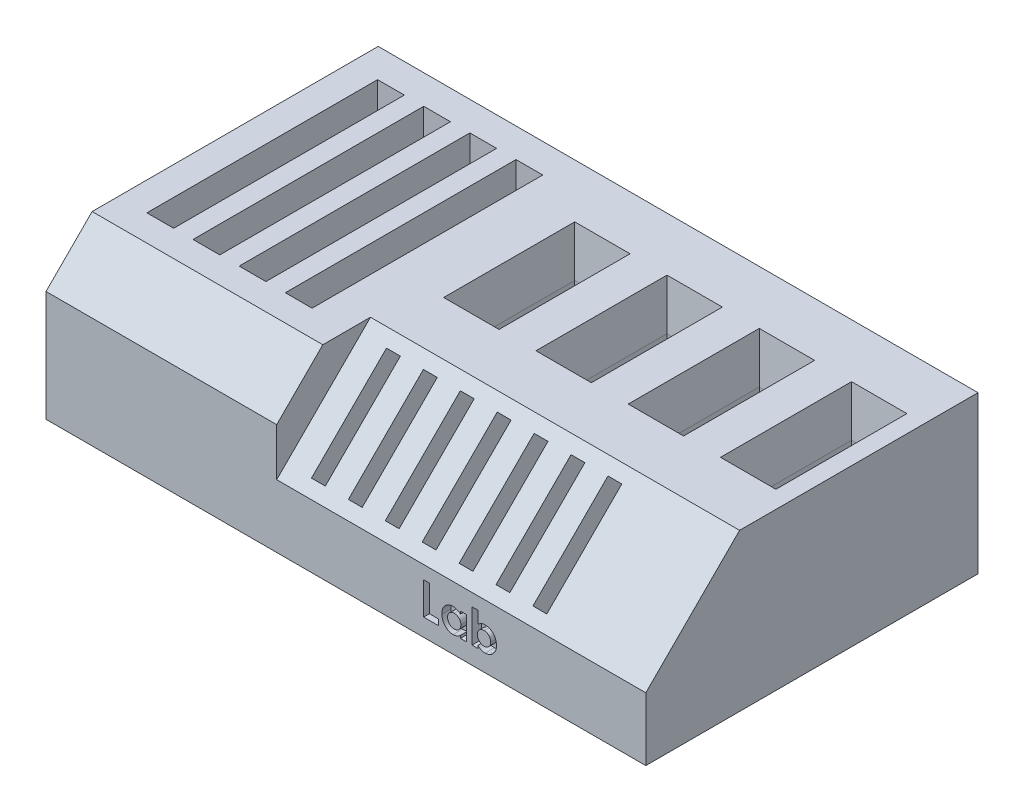
from build123d import *

# Parameters (mm, degrees)
CROQUIS1_W              = 36
CROQUIS1_H              = 17
SALIENTE_EXTRUIR1_DEPTH = 65
CHAFL_N1_SIZE           = 5
CROQUIS2_W              = 2.9
CROQUIS2_H              = 25
CORTAR_EXTRUIR1_DEPTH   = 14
CORTAR_EXTRUIR2_DEPTH   = 40
CROQUIS9_W              = 1.5
CROQUIS9_H              = 11.5
CORTAR_EXTRUIR3_DEPTH   = 10
CROQUIS10_W             = 5
CROQUIS10_H             = 13.2
CORTAR_EXTRUIR4_DEPTH   = 13
CHAFL_N2_SIZE           = 0.5
CHAFL_N2_SIZE2          = 5
CHAFL_N4_SIZE           = 0.5
CHAFL_N4_SIZE2          = 5
CHAFL_N5_SIZE           = 0.5
CHAFL_N5_SIZE2          = 5
CORTAR_EXTRUIR5_DEPTH   = 1


with BuildPart() as part:
    # Croquis1 → Saliente-Extruir1 (new body)
    with BuildSketch(Plane(origin=(0, 0, 0), x_dir=(0, 0, -1), z_dir=(1, 0, 0))):
        Rectangle(CROQUIS1_W, CROQUIS1_H)
    extrude(amount=SALIENTE_EXTRUIR1_DEPTH)

    # Chaflán1
    chafl_n1_edges = [part.edges().sort_by_distance(p)[0] for p in [
        (32.5, 8.5, 18),
    ]]
    chamfer(chafl_n1_edges, length=CHAFL_N1_SIZE)

    # Croquis2 → Cortar-Extruir1 (cut)
    with BuildSketch(Plane(origin=(0, 8.5, 0), x_dir=(1, 0, 0), z_dir=(0, 1, 0))):
        with Locations((9.537285555, 2.346326753)):
            Rectangle(CROQUIS2_W, CROQUIS2_H)
        with Locations((4.537285555, 2.346326753)):
            Rectangle(CROQUIS2_W, CROQUIS2_H)
        with Locations((14.537285555, 2.346326753)):
            Rectangle(CROQUIS2_W, CROQUIS2_H)
        with Locations((19.537285555, 2.346326753)):
            Rectangle(CROQUIS2_W, CROQUIS2_H)
    extrude(amount=-CORTAR_EXTRUIR1_DEPTH, mode=Mode.SUBTRACT)

    # Croquis7 → Cortar-Extruir2 (cut)
    with BuildSketch(Plane(origin=(65, 0, 0), x_dir=(0, 0, -1), z_dir=(1, 0, 0))):
        Polygon((-18, -1.664897079), (-7.835102921, 8.5), (-13, 8.5), (-18, 3.5), align=None)
    extrude(amount=-CORTAR_EXTRUIR2_DEPTH, mode=Mode.SUBTRACT)

    # Croquis9 → Cortar-Extruir3 (cut)
    with BuildSketch(Plane(origin=(0, 8.16755146, 8.16755146), x_dir=(1, 0, 0), z_dir=(0, 0.7071067811865487, 0.7071067811865464))):
        with Locations((28.502109808, -6.717514421)):
            Rectangle(CROQUIS9_W, CROQUIS9_H)
        with Locations((32.502109808, -6.717514421)):
            Rectangle(CROQUIS9_W, CROQUIS9_H)
        with Locations((36.502109808, -6.717514421)):
            Rectangle(CROQUIS9_W, CROQUIS9_H)
        with Locations((40.502109808, -6.717514421)):
            Rectangle(CROQUIS9_W, CROQUIS9_H)
        with Locations((44.502109808, -6.717514421)):
            Rectangle(CROQUIS9_W, CROQUIS9_H)
        with Locations((48.502109808, -6.717514421)):
            Rectangle(CROQUIS9_W, CROQUIS9_H)
        with Locations((52.502109808, -6.717514421)):
            Rectangle(CROQUIS9_W, CROQUIS9_H)
    extrude(amount=-CORTAR_EXTRUIR3_DEPTH, mode=Mode.SUBTRACT)

    # Croquis10 → Cortar-Extruir4 (cut)
    with BuildSketch(Plane(origin=(0, 8.5, 0), x_dir=(1, 0, 0), z_dir=(0, 1, 0))):
        with Locations((40.114166644, 5.08244854)):
            Rectangle(CROQUIS10_W, CROQUIS10_H)
        with Locations((30.114166644, 5.08244854)):
            Rectangle(CROQUIS10_W, CROQUIS10_H)
        with Locations((50.114166644, 5.08244854)):
            Rectangle(CROQUIS10_W, CROQUIS10_H)
        with Locations((60.114166644, 5.08244854)):
            Rectangle(CROQUIS10_W, CROQUIS10_H)
    extrude(amount=-CORTAR_EXTRUIR4_DEPTH, mode=Mode.SUBTRACT)

    # Chaflán2
    chafl_n2_edges = [part.edges().sort_by_distance(p)[0] for p in [
        (27.614166644, 8.5, -5.08244854),
    ]]
    chafl_n2_side = [part.faces().sort_by_distance(p)[0] for p in [
        (0.720138875, 8.5, -2.5),
    ]]
    chamfer(chafl_n2_edges, length=CHAFL_N2_SIZE, length2=CHAFL_N2_SIZE2, reference=chafl_n2_side[0])

    # Chaflán4
    chafl_n4_edges = [part.edges().sort_by_distance(p)[0] for p in [
        (29.864166644, 8.5, 1.51755146),
        (32.614166644, 8.5, -5.08244854),
        (29.864166644, 8.5, -11.68244854),
    ]]
    chafl_n4_side = [part.faces().sort_by_distance(p)[0] for p in [
        (29.864166644, 8.5, 2.237690336),
    ]]
    chamfer(chafl_n4_edges, length=CHAFL_N4_SIZE, length2=CHAFL_N4_SIZE2, reference=chafl_n4_side[0])

    # Chaflán5
    chafl_n5_edges = [part.edges().sort_by_distance(p)[0] for p in [
        (37.614166644, 8.5, -5.08244854),
        (40.114166644, 8.5, 1.51755146),
        (42.614166644, 8.5, -5.08244854),
        (40.114166644, 8.5, -11.68244854),
        (47.614166644, 8.5, -5.08244854),
        (50.114166644, 8.5, 1.51755146),
        (52.614166644, 8.5, -5.08244854),
        (50.114166644, 8.5, -11.68244854),
        (57.614166644, 8.5, -5.08244854),
        (60.114166644, 8.5, 1.51755146),
        (62.614166644, 8.5, -5.08244854),
        (60.114166644, 8.5, -11.68244854),
    ]]
    chafl_n5_side = [part.faces().sort_by_distance(p)[0] for p in [
        (26.394027769, 8.5, -5.08244854),
    ]]
    chamfer(chafl_n5_edges, length=CHAFL_N5_SIZE, length2=CHAFL_N5_SIZE2, reference=chafl_n5_side[0])

    # Croquis11 → Cortar-Extruir5 (cut)
    # profile 1 of 3: a face of its own
    with BuildSketch(Plane.XY.offset(18)):
        Polygon((40.921288965, -3.099012661), (41.549494093, -3.099012661), (41.549494093, -5.970807532), (42.536673581, -5.970807532), (42.536673581, -6.599012661), (40.921288965, -6.599012661), align=None)
    # profile 2 of 3: a face of its own
    with BuildSketch(Plane.XY.offset(18)):
        with BuildLine():
            Line((44.914878709, -4.041320353), (45.543083837, -4.041320353))
            Line((45.543083837, -4.041320353), (45.543083837, -6.599012661))
            Line((45.543083837, -6.599012661), (44.914878709, -6.599012661))
            Line((44.914878709, -6.599012661), (44.914878709, -6.319966186))
            add(Edge.make_bspline(
                [(44.914878709, -6.319966186), (44.883751376, -6.347128272), (44.82333937, -6.399844517), (44.728149598, -6.468245185), (44.63268167, -6.524666896), (44.53647686, -6.569603711), (44.438056541, -6.602784924), (44.336712126, -6.626808898), (44.230984148, -6.640976423), (44.159111725, -6.642905014), (44.122611081, -6.643884456)],
                knots=[0, 0, 0, 0, 1.129196829, 2.191548051, 3.199897424, 4.157751732, 5.089409408, 6.034969131, 7.002052659, 8, 8, 8, 8], degree=3))
            add(Edge.make_bspline(
                [(44.122611081, -6.643884456), (44.081637484, -6.642962678), (44.000671336, -6.641141193), (43.881862503, -6.621967123), (43.767140762, -6.592616936), (43.656599237, -6.551082753), (43.550439047, -6.497262594), (43.447847746, -6.432560703), (43.35058406, -6.354705656), (43.257838303, -6.267066042), (43.172920844, -6.170661844), (43.0986852, -6.066831137), (43.036110069, -5.957046532), (42.984845613, -5.841672015), (42.944519498, -5.720792265), (42.915772749, -5.594023887), (42.898812133, -5.461321606), (42.896712887, -5.370930009), (42.895647939, -5.325074359)],
                knots=[0, 0, 0, 0, 0.980476535, 1.937477201, 2.874147792, 3.812856188, 4.758993464, 5.720109578, 6.712210464, 7.737600662, 8.772720504, 9.783789959, 10.789002326, 11.793715968, 12.802552247, 13.835794126, 14.902098527, 16, 16, 16, 16], degree=3))
            add(Edge.make_bspline(
                [(42.895647939, -5.325074359), (42.896765606, -5.277590773), (42.898958033, -5.184446429), (42.914995506, -5.047761532), (42.94321177, -4.917849943), (42.981686674, -4.794531714), (43.031177957, -4.677785542), (43.091455033, -4.567420158), (43.163337916, -4.463724041), (43.246170194, -4.368462171), (43.335608711, -4.281150065), (43.431292112, -4.205137953), (43.531724119, -4.140562127), (43.637011458, -4.087843194), (43.747139094, -4.04710467), (43.861672245, -4.017321482), (43.981119356, -3.999450523), (44.062487696, -3.997457523), (44.103680792, -3.996448558)],
                knots=[0, 0, 0, 0, 1.136281865, 2.228943489, 3.287578264, 4.313574083, 5.316051562, 6.317280042, 7.318008486, 8.329309503, 9.333984563, 10.305318864, 11.248632312, 12.186624717, 13.117503092, 14.05354244, 15.014596925, 16, 16, 16, 16], degree=3))
            add(Edge.make_bspline(
                [(44.103680792, -3.996448558), (44.141838946, -3.997241302), (44.217340179, -3.998809856), (44.328316113, -4.015841349), (44.435946763, -4.041600274), (44.539644998, -4.078302105), (44.640261386, -4.124645634), (44.736065262, -4.182717529), (44.829152421, -4.250077056), (44.885950224, -4.302686273), (44.914878709, -4.329481411)],
                knots=[0, 0, 0, 0, 1.017011718, 2.012299608, 2.98747302, 3.965332399, 4.941441765, 5.936729654, 6.94912688, 8, 8, 8, 8], degree=3))
            Line((44.914878709, -4.329481411), (44.914878709, -4.041320353))
        make_face()
        with BuildLine():
            add(Edge.make_bspline(
                [(44.235491689, -4.579781891), (44.210459567, -4.580549963), (44.161398241, -4.582055334), (44.089246848, -4.591110245), (44.02029176, -4.6070654), (43.95502476, -4.630635717), (43.892473131, -4.659347797), (43.833586727, -4.695309204), (43.777879543, -4.737814823), (43.725679198, -4.785835594), (43.678090892, -4.838619201), (43.637066994, -4.896217552), (43.602203309, -4.9570787), (43.572717693, -5.021385632), (43.551612681, -5.089899299), (43.53489752, -5.161727774), (43.526223434, -5.23745786), (43.524651096, -5.28906557), (43.523853068, -5.315258654)],
                knots=[0, 0, 0, 0, 1.04836806, 2.054732945, 3.03993516, 4.00574415, 4.955904794, 5.917688631, 6.888591924, 7.88601754, 8.884115178, 9.859153345, 10.841239365, 11.818093293, 12.814750328, 13.83810466, 14.90274714, 16, 16, 16, 16], degree=3))
            add(Edge.make_bspline(
                [(43.523853068, -5.315258654), (43.524638906, -5.341689325), (43.52618739, -5.393770655), (43.535037772, -5.470139552), (43.551151452, -5.543017272), (43.574660704, -5.611814651), (43.603370953, -5.677459991), (43.638317783, -5.739650334), (43.681243843, -5.797286076), (43.728873866, -5.851731073), (43.782145093, -5.900348343), (43.838167491, -5.943516014), (43.897706281, -5.979634377), (43.96011551, -6.008825467), (44.025185106, -6.032613751), (44.093730843, -6.048368383), (44.165081229, -6.058440022), (44.213722672, -6.059842563), (44.238296177, -6.060551122)],
                knots=[0, 0, 0, 0, 1.099136573, 2.165835871, 3.191374663, 4.196217796, 5.183857741, 6.167377911, 7.154730987, 8.166690795, 9.170734848, 10.148332609, 11.103258353, 12.059567475, 13.009337315, 13.978056681, 14.978520572, 16, 16, 16, 16], degree=3))
            add(Edge.make_bspline(
                [(44.238296177, -6.060551122), (44.263794552, -6.059778744), (44.313785228, -6.058264464), (44.387113735, -6.049292189), (44.456995137, -6.033278532), (44.52313869, -6.00957327), (44.586554673, -5.981067286), (44.646670814, -5.945808593), (44.702834763, -5.903400512), (44.755330964, -5.854945632), (44.803433612, -5.801731016), (44.845024838, -5.743377353), (44.881252317, -5.681750956), (44.909743562, -5.61539475), (44.932369606, -5.545469661), (44.948603271, -5.471541717), (44.957433444, -5.393531216), (44.958968385, -5.340286009), (44.959750504, -5.313155289)],
                knots=[0, 0, 0, 0, 1.050008698, 2.058587853, 3.036635738, 3.995319155, 4.947022481, 5.895997462, 6.858296291, 7.838991643, 8.833936038, 9.806048392, 10.784806122, 11.771666913, 12.772873988, 13.80724452, 14.882696879, 16, 16, 16, 16], degree=3))
            add(Edge.make_bspline(
                [(44.959750504, -5.313155289), (44.958978104, -5.286491204), (44.957469382, -5.234408501), (44.948565189, -5.158026822), (44.932216274, -5.085550486), (44.910055911, -5.01684627), (44.881057798, -4.952071268), (44.844802908, -4.891943678), (44.803667915, -4.834380306), (44.7550327, -4.78260331), (44.702820883, -4.734499281), (44.645830953, -4.693373652), (44.5858584, -4.657930443), (44.522534755, -4.628830202), (44.455273666, -4.607498622), (44.385272842, -4.590982361), (44.311440123, -4.582060769), (44.261220965, -4.580553913), (44.235491689, -4.579781891)],
                knots=[0, 0, 0, 0, 1.106611376, 2.161533483, 3.185006901, 4.184773755, 5.152708835, 6.122342771, 7.094156588, 8.082475533, 9.064254463, 10.03606828, 10.992420271, 11.951521816, 12.920622147, 13.915721683, 14.932141191, 16, 16, 16, 16], degree=3))
        make_face(mode=Mode.SUBTRACT)
    # profile 3 of 3: a face of its own
    with BuildSketch(Plane.XY.offset(18)):
        with BuildLine():
            Line((46.799494093, -3.009269071), (46.799494093, -4.339297116))
            add(Edge.make_bspline(
                [(46.799494093, -4.339297116), (46.828665066, -4.311830886), (46.88592924, -4.257913216), (46.979425562, -4.188191766), (47.076276616, -4.129347434), (47.176395637, -4.079979793), (47.280683706, -4.04347455), (47.387859455, -4.015108609), (47.499021084, -4.000085409), (47.574194996, -3.997667538), (47.612094254, -3.996448558)],
                knots=[0, 0, 0, 0, 1.061187343, 2.083167259, 3.083809127, 4.061667593, 5.035358583, 6.007314429, 6.995378812, 8, 8, 8, 8], degree=3))
            add(Edge.make_bspline(
                [(47.612094254, -3.996448558), (47.653291261, -3.99743533), (47.734435997, -3.999378951), (47.853825038, -4.017525446), (47.968237876, -4.046858005), (48.078110797, -4.087814252), (48.182858412, -4.1409891), (48.283657633, -4.204655939), (48.378770061, -4.281442014), (48.468241931, -4.368415119), (48.551005641, -4.463744102), (48.622994826, -4.567386939), (48.682959023, -4.677979492), (48.733781627, -4.794214325), (48.770874004, -4.918019154), (48.799461714, -5.047733221), (48.81539239, -5.184453934), (48.81759964, -5.277593308), (48.818724863, -5.325074359)],
                knots=[0, 0, 0, 0, 0.985987466, 1.942075377, 2.884088208, 3.810275091, 4.743821533, 5.692411115, 6.659945104, 7.665215984, 8.677116751, 9.678438675, 10.680260931, 11.685531812, 12.710472044, 13.769734641, 14.863044265, 16, 16, 16, 16], degree=3))
            add(Edge.make_bspline(
                [(48.818724863, -5.325074359), (48.817659914, -5.370930008), (48.815560666, -5.461321602), (48.798600064, -5.594023901), (48.769853265, -5.720792215), (48.729527331, -5.841672198), (48.678262205, -5.957045853), (48.615689579, -6.06683368), (48.541444456, -6.170652194), (48.45656312, -6.267102854), (48.363817926, -6.354446097), (48.267184081, -6.432810351), (48.164736958, -6.497023711), (48.059037505, -6.551256814), (47.948420555, -6.592727818), (47.833641671, -6.621782918), (47.714882635, -6.641208054), (47.634140955, -6.642983436), (47.593163965, -6.643884456)],
                knots=[0, 0, 0, 0, 1.098553145, 2.165490463, 3.199345634, 4.208780719, 5.21409072, 6.219899742, 7.23156933, 8.267303578, 9.293302409, 10.281606823, 11.243293419, 12.184993323, 13.124258899, 14.066907486, 15.018941492, 16, 16, 16, 16], degree=3))
            add(Edge.make_bspline(
                [(47.593163965, -6.643884456), (47.556662682, -6.64290868), (47.484789003, -6.640987307), (47.378844207, -6.626736924), (47.277035106, -6.602770527), (47.178075606, -6.569756661), (47.0816972, -6.524650013), (46.986221456, -6.46825005), (46.891033911, -6.399843183), (46.830621589, -6.347127819), (46.799494093, -6.319966186)],
                knots=[0, 0, 0, 0, 0.996418773, 1.962021009, 2.912343664, 3.848616743, 4.805003894, 5.811808768, 6.872532775, 8, 8, 8, 8], degree=3))
            Line((46.799494093, -6.319966186), (46.799494093, -6.599012661))
            Line((46.799494093, -6.599012661), (46.171288965, -6.599012661))
            Line((46.171288965, -6.599012661), (46.171288965, -3.009269071))
            Line((46.171288965, -3.009269071), (46.799494093, -3.009269071))
        make_face()
        with BuildLine():
            add(Edge.make_bspline(
                [(47.476076625, -4.579781891), (47.450582187, -4.580565863), (47.400599229, -4.582102873), (47.327215143, -4.590911473), (47.257682429, -4.607484917), (47.190943899, -4.628965797), (47.127844655, -4.657961612), (47.067868473, -4.693110501), (47.011529055, -4.735022867), (46.958534001, -4.782039033), (46.910913732, -4.834932308), (46.868607254, -4.891451516), (46.833508394, -4.952332643), (46.80424967, -5.016803724), (46.78217524, -5.085562329), (46.765802409, -5.158023528), (46.756904813, -5.234409382), (46.75539517, -5.286491503), (46.754622298, -5.313155289)],
                knots=[0, 0, 0, 0, 1.060469436, 2.079096586, 3.066888298, 4.028858836, 4.99004353, 5.948472697, 6.914558426, 7.905691313, 8.889602648, 9.869280844, 10.836099585, 11.806137001, 12.808075328, 13.83377171, 14.890985086, 16, 16, 16, 16], degree=3))
            add(Edge.make_bspline(
                [(46.754622298, -5.313155289), (46.755404895, -5.340285713), (46.756940775, -5.393530339), (46.765764198, -5.471545019), (46.782022109, -5.545457951), (46.804561467, -5.615436713), (46.833322315, -5.681490386), (46.868379589, -5.74386384), (46.911151752, -5.801189569), (46.958248895, -5.855477411), (47.011571631, -5.903122664), (47.067657238, -5.945853901), (47.127830084, -5.981055183), (47.191230882, -6.009576541), (47.257378552, -6.033277634), (47.32725882, -6.049292439), (47.400587639, -6.058264397), (47.450578272, -6.059778722), (47.476076625, -6.060551122)],
                knots=[0, 0, 0, 0, 1.117193555, 2.192540452, 3.22680955, 4.227918444, 5.21468246, 6.188555072, 7.166222992, 8.154674427, 9.142376254, 10.104580718, 11.053462639, 12.005072638, 12.963662044, 13.941614018, 14.950094269, 16, 16, 16, 16], degree=3))
            add(Edge.make_bspline(
                [(47.476076625, -6.060551122), (47.500647484, -6.059833586), (47.549283689, -6.058413276), (47.620446696, -6.04850285), (47.688852075, -6.032308228), (47.753964122, -6.009225035), (47.816179199, -5.97917074), (47.876063694, -5.944002241), (47.931550169, -5.900061828), (47.984815451, -5.851767562), (48.032473648, -5.797305519), (48.075228779, -5.739446772), (48.111144359, -5.67767492), (48.139660484, -5.611785117), (48.163235577, -5.543025412), (48.179331036, -5.470137266), (48.188186463, -5.393771257), (48.18973425, -5.341689527), (48.190519734, -5.315258654)],
                knots=[0, 0, 0, 0, 1.021711385, 2.02240246, 2.981887075, 3.941027022, 4.888772411, 5.852236371, 6.822344989, 7.82661704, 8.838806642, 9.826383926, 10.814965113, 11.80282933, 12.807900643, 13.833672313, 14.900613836, 16, 16, 16, 16], degree=3))
            add(Edge.make_bspline(
                [(48.190519734, -5.315258654), (48.189721707, -5.28906557), (48.188149368, -5.23745786), (48.179475282, -5.161727775), (48.162760122, -5.089899297), (48.141655106, -5.02138564), (48.112169506, -4.957078672), (48.077305758, -4.896217654), (48.036282098, -4.838618819), (47.988692886, -4.785837055), (47.936495907, -4.737809441), (47.880776522, -4.69532862), (47.821753544, -4.659165338), (47.758623211, -4.630646494), (47.692875298, -4.607181631), (47.623505041, -4.591018724), (47.550865112, -4.582073267), (47.501340946, -4.580555942), (47.476076625, -4.579781891)],
                knots=[0, 0, 0, 0, 1.094680664, 2.156827393, 3.177782763, 4.17210342, 5.146667393, 6.126451192, 7.099203661, 8.094961544, 9.09004898, 10.058676268, 11.018205477, 11.974998356, 12.947750825, 13.930643515, 14.944335875, 16, 16, 16, 16], degree=3))
        make_face(mode=Mode.SUBTRACT)
    extrude(amount=-CORTAR_EXTRUIR5_DEPTH, mode=Mode.SUBTRACT)


solid = part.part
